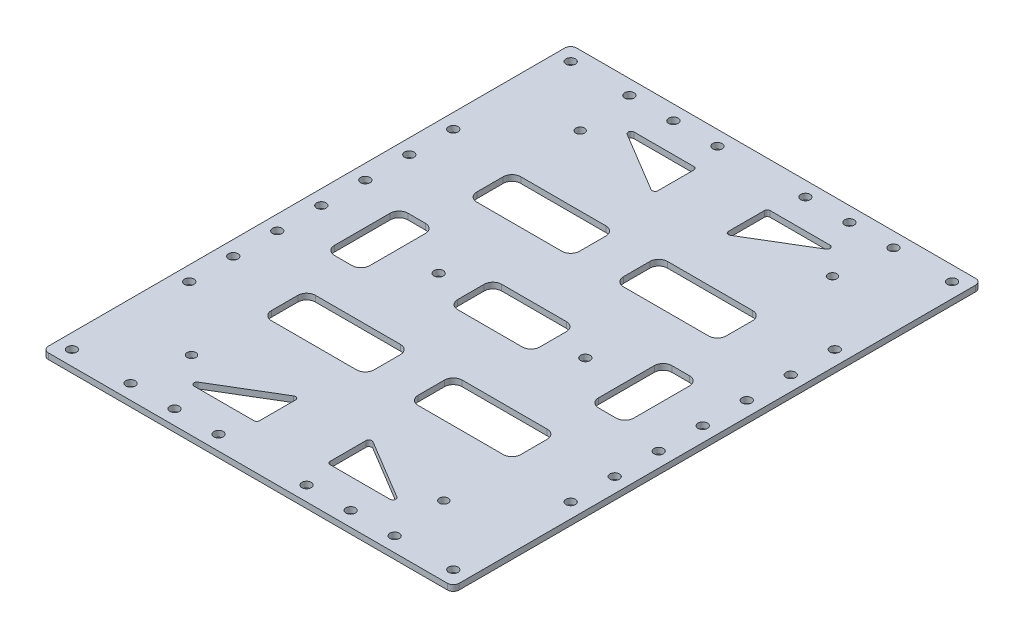
from build123d import *

# Parameters (mm, degrees)
SKETCH_1_W               = 180
SKETCH_1_H               = 180
EXTRUDE_1_DEPTH          = 2
SKETCH_2_R               = 1.5
CUT_EXTRUDE_1_DEPTH      = 3
SKETCH_3_W               = 28
SKETCH_3_H               = 15
SKETCH_3_W_2             = 35
SKETCH_3_W_3             = 12
SKETCH_3_H_2             = 25
CUT_EXTRUDE_2_DEPTH      = 3
FILLET_1_R               = 3
SKETCH_5_R               = 1.7
CUT_EXTRUDE_3_DEPTH      = 128.294933128
CUT_EXTRUDE_4_DEPTH      = 10
SKETCH_7_R               = 1.6
CUT_EXTRUDE_5_DEPTH      = 10
FILLET_2_R               = 3
FILLET_3_R               = 1
CUT_EXTRUDE_6_DEPTH      = 128.294933128
CUT_EXTRUDE_6_DEPTH_BACK = 128.294933128
SKETCH_8_R               = 1.6
FILLET_4_R               = 2


with BuildPart() as part:
    # 草图1 → 凸台-拉伸1 (new body)
    with BuildSketch(Plane(origin=(0, 0, 0), x_dir=(1, 0, 0), z_dir=(0, 1, 0))):
        Rectangle(SKETCH_1_W, SKETCH_1_H)
    extrude(amount=EXTRUDE_1_DEPTH)

    # 草图2 → 切除-拉伸1 (cut)
    with BuildSketch(Plane(origin=(0, 2, 0), x_dir=(1, 0, 0), z_dir=(0, 1, 0))):
        with Locations(Location((-42.9895, 66.2305, 0), (0, 0, 270))):
            Circle(SKETCH_2_R)
        with Locations(Location((42.9895, 66.2305, 0), (0, 0, 270))):
            Circle(SKETCH_2_R)
        with Locations(Location((-42.9895, -66.2305, 0), (0, 0, 270))):
            Circle(SKETCH_2_R)
        with Locations(Location((42.9895, -66.2305, 0), (0, 0, 270))):
            Circle(SKETCH_2_R)
    extrude(amount=-CUT_EXTRUDE_1_DEPTH, mode=Mode.SUBTRACT)

    # 草图3 → 切除-拉伸2 (cut)
    with BuildSketch(Plane(origin=(0, 2, 0), x_dir=(1, 0, 0), z_dir=(0, 1, 0))):
        Rectangle(SKETCH_3_W, SKETCH_3_H)
        with Locations((-25, 35)):
            Rectangle(SKETCH_3_W_2, SKETCH_3_H)
        with Locations((25, 35)):
            Rectangle(SKETCH_3_W_2, SKETCH_3_H)
        with Locations((45, 0)):
            Rectangle(SKETCH_3_W_3, SKETCH_3_H_2)
        with Locations((-45, 0)):
            Rectangle(SKETCH_3_W_3, SKETCH_3_H_2)
        with Locations((-25, -35)):
            Rectangle(SKETCH_3_W_2, SKETCH_3_H)
        with Locations((25, -35)):
            Rectangle(SKETCH_3_W_2, SKETCH_3_H)
        Polygon((-37, 75), (-12, 75), (-12, 60), align=None)
        Polygon((12, 75), (12, 60), (37, 75), align=None)
        Polygon((37, -75), (12, -75), (12, -60), align=None)
        Polygon((-12, -75), (-12, -60), (-37, -75), align=None)
    extrude(amount=-CUT_EXTRUDE_2_DEPTH, mode=Mode.SUBTRACT)

    # 圆角1
    fillet_1_edges = [part.edges().sort_by_distance(p)[0] for p in [
        (14, 1, -7.5),
        (14, 1, 7.5),
        (-14, 1, 7.5),
        (-14, 1, -7.5),
    ]]
    fillet(fillet_1_edges, radius=FILLET_1_R)

    # 草图5 → 切除-拉伸3 (cut, through all)
    with BuildSketch(Plane(origin=(0, 2, 0), x_dir=(1, 0, 0), z_dir=(0, 1, 0))):
        with Locations(Location((77.5, 69.014718626, 0), (0, 0, 270))):
            Circle(SKETCH_5_R)
        with Locations(Location((77.5, 85.985281374, 0), (0, 0, 270))):
            Circle(SKETCH_5_R)
        with Locations(Location((85.985281374, 77.5, 0), (0, 0, 270))):
            Circle(SKETCH_5_R)
        with Locations(Location((-85.985281374, 77.5, 0), (0, 0, 90))):
            Circle(SKETCH_5_R)
        with Locations(Location((-77.5, 85.985281374, 0), (0, 0, 90))):
            Circle(SKETCH_5_R)
        with Locations(Location((-77.5, -85.985281374, 0), (0, 0, 270))):
            Circle(SKETCH_5_R)
        with Locations(Location((-85.985281374, -77.5, 0), (0, 0, 270))):
            Circle(SKETCH_5_R)
        with Locations(Location((85.985281374, -77.5, 0), (0, 0, 90))):
            Circle(SKETCH_5_R)
        with Locations(Location((77.5, -85.985281374, 0), (0, 0, 90))):
            Circle(SKETCH_5_R)
        Polygon((80, 90), (90, 80), (90, 90), align=None)
        Polygon((-90, 90), (-80, 90), (-90, 80), align=None)
        Polygon((-80, -90), (-90, -80), (-90, -90), align=None)
        Polygon((90, -90), (80, -90), (90, -80), align=None)
    extrude(amount=-CUT_EXTRUDE_3_DEPTH, mode=Mode.SUBTRACT)

    # 草图6 → 切除-拉伸4 (cut)
    with BuildSketch(Plane(origin=(0, 2, 0), x_dir=(1, 0, 0), z_dir=(0, 1, 0))):
        Polygon((90, 70), (70, 50), (70, -50), (90, -70), align=None)
        Polygon((-70, -50), (-90, -70), (-90, 70), (-70, 50), align=None)
    extrude(amount=-CUT_EXTRUDE_4_DEPTH, mode=Mode.SUBTRACT)

    # 草图7 → 切除-拉伸5 (cut)
    with BuildSketch(Plane.XZ):
        with Locations(Location((-65, 30, 0), (0, 0, 270))):
            Circle(SKETCH_7_R)
        with Locations(Location((-65, 15, 0), (0, 0, 270))):
            Circle(SKETCH_7_R)
        with Locations(Location((-65, 45, 0), (0, 0, 270))):
            Circle(SKETCH_7_R)
        with Locations(Location((-45, 85, 0), (0, 0, 270))):
            Circle(SKETCH_7_R)
        with Locations(Location((-30, 85, 0), (0, 0, 270))):
            Circle(SKETCH_7_R)
        with Locations(Location((-15, 85, 0), (0, 0, 270))):
            Circle(SKETCH_7_R)
        with Locations(Location((15, 85, 0), (0, 0, 270))):
            Circle(SKETCH_7_R)
        with Locations(Location((30, 85, 0), (0, 0, 270))):
            Circle(SKETCH_7_R)
        with Locations(Location((45, 85, 0), (0, 0, 270))):
            Circle(SKETCH_7_R)
        with Locations(Location((-65, -45, 0), (0, 0, 270))):
            Circle(SKETCH_7_R)
        with Locations(Location((-65, -15, 0), (0, 0, 270))):
            Circle(SKETCH_7_R)
        with Locations(Location((-65, -30, 0), (0, 0, 270))):
            Circle(SKETCH_7_R)
        with Locations(Location((65, -30, 0), (0, 0, 270))):
            Circle(SKETCH_7_R)
        with Locations(Location((65, -15, 0), (0, 0, 270))):
            Circle(SKETCH_7_R)
        with Locations(Location((65, -45, 0), (0, 0, 270))):
            Circle(SKETCH_7_R)
        with Locations(Location((65, 45, 0), (0, 0, 270))):
            Circle(SKETCH_7_R)
        with Locations(Location((65, 15, 0), (0, 0, 270))):
            Circle(SKETCH_7_R)
        with Locations(Location((65, 30, 0), (0, 0, 270))):
            Circle(SKETCH_7_R)
        with Locations(Location((45, -85, 0), (0, 0, 270))):
            Circle(SKETCH_7_R)
        with Locations(Location((30, -85, 0), (0, 0, 270))):
            Circle(SKETCH_7_R)
        with Locations(Location((15, -85, 0), (0, 0, 270))):
            Circle(SKETCH_7_R)
        with Locations(Location((-15, -85, 0), (0, 0, 270))):
            Circle(SKETCH_7_R)
        with Locations(Location((-30, -85, 0), (0, 0, 270))):
            Circle(SKETCH_7_R)
        with Locations(Location((-45, -85, 0), (0, 0, 270))):
            Circle(SKETCH_7_R)
        with Locations(Location((-65, 85, 0), (0, 0, 270))):
            Circle(SKETCH_7_R)
        with Locations(Location((65, 85, 0), (0, 0, 270))):
            Circle(SKETCH_7_R)
        with Locations(Location((65, -85, 0), (0, 0, 270))):
            Circle(SKETCH_7_R)
        with Locations(Location((-65, -85, 0), (0, 0, 270))):
            Circle(SKETCH_7_R)
    extrude(amount=-CUT_EXTRUDE_5_DEPTH, mode=Mode.SUBTRACT)

    # 圆角2
    fillet_2_edges = [part.edges().sort_by_distance(p)[0] for p in [
        (42.5, 1, -42.5),
        (42.5, 1, -27.5),
        (7.5, 1, -27.5),
        (7.5, 1, -42.5),
        (-39, 1, -12.5),
        (-39, 1, 12.5),
        (-51, 1, 12.5),
        (-51, 1, -12.5),
        (51, 1, -12.5),
        (51, 1, 12.5),
        (39, 1, 12.5),
        (39, 1, -12.5),
        (-42.5, 1, 42.5),
        (-42.5, 1, 27.5),
        (-7.5, 1, 27.5),
        (-7.5, 1, 42.5),
        (7.5, 1, 27.5),
        (42.5, 1, 27.5),
        (42.5, 1, 42.5),
        (7.5, 1, 42.5),
        (-90, 1, -80),
        (-80, 1, -90),
        (80, 1, -90),
        (90, 1, -80),
        (90, 1, 80),
        (80, 1, 90),
        (-80, 1, 90),
        (-90, 1, 80),
        (90, 1, -70),
        (90, 1, 70),
        (70, 1, 50),
        (70, 1, -50),
        (-70, 1, -50),
        (-70, 1, 50),
        (-90, 1, 70),
        (-90, 1, -70),
        (-7.5, 1, -42.5),
        (-7.5, 1, -27.5),
        (-42.5, 1, -27.5),
        (-42.5, 1, -42.5),
    ]]
    fillet(fillet_2_edges, radius=FILLET_2_R)

    # 圆角3
    fillet_3_edges = [part.edges().sort_by_distance(p)[0] for p in [
        (-12, 1, -60),
        (-37, 1, -75),
        (-12, 1, -75),
        (12, 1, -75),
        (37, 1, -75),
        (12, 1, -60),
        (-12, 1, 75),
        (-37, 1, 75),
        (-12, 1, 60),
        (12, 1, 60),
        (37, 1, 75),
        (12, 1, 75),
    ]]
    fillet(fillet_3_edges, radius=FILLET_3_R)

    # 草图8 → 切除-拉伸6 (cut, two sides: drawn at the far end of the back side and taken through both)
    with BuildSketch(Plane(origin=(0, 2, 0), x_dir=(1, 0, 0), z_dir=(0, 1, 0)).offset(-CUT_EXTRUDE_6_DEPTH_BACK)):
        with BuildLine():
            Line((-70, 48.757359313), (-70, 90))
            Line((-70, 90), (-78.757359313, 90))
            ThreePointArc((-78.757359313, 90), (-79.90540961, 89.771638598), (-80.878679656, 89.121320344))
            Line((-80.878679656, 89.121320344), (-89.121320344, 80.878679656))
            ThreePointArc((-89.121320344, 80.878679656), (-89.771638598, 79.90540961), (-90, 78.757359313))
            Line((-90, 78.757359313), (-90, 71.242640687))
            ThreePointArc((-90, 71.242640687), (-89.771638598, 70.09459039), (-89.121320344, 69.121320344))
            Line((-89.121320344, 69.121320344), (-70.878679656, 50.878679656))
            ThreePointArc((-70.878679656, 50.878679656), (-70.228361402, 49.90540961), (-70, 48.757359313))
        make_face()
        with BuildLine():
            Line((-70, -90), (-70, -48.757359313))
            ThreePointArc((-70, -48.757359313), (-70.228361402, -49.90540961), (-70.878679656, -50.878679656))
            Line((-70.878679656, -50.878679656), (-89.121320344, -69.121320344))
            ThreePointArc((-89.121320344, -69.121320344), (-89.771638598, -70.09459039), (-90, -71.242640687))
            Line((-90, -71.242640687), (-90, -78.757359313))
            ThreePointArc((-90, -78.757359313), (-89.771638598, -79.90540961), (-89.121320344, -80.878679656))
            Line((-89.121320344, -80.878679656), (-80.878679656, -89.121320344))
            ThreePointArc((-80.878679656, -89.121320344), (-79.90540961, -89.771638598), (-78.757359313, -90))
            Line((-78.757359313, -90), (-70, -90))
        make_face()
        with BuildLine():
            ThreePointArc((70.878679656, -50.878679656), (70.228361402, -49.90540961), (70, -48.757359313))
            Line((70, -48.757359313), (70, -90))
            Line((70, -90), (78.757359313, -90))
            ThreePointArc((78.757359313, -90), (79.90540961, -89.771638598), (80.878679656, -89.121320344))
            Line((80.878679656, -89.121320344), (89.121320344, -80.878679656))
            ThreePointArc((89.121320344, -80.878679656), (89.771638598, -79.90540961), (90, -78.757359313))
            Line((90, -78.757359313), (90, -71.242640687))
            ThreePointArc((90, -71.242640687), (89.771638598, -70.09459039), (89.121320344, -69.121320344))
            Line((89.121320344, -69.121320344), (70.878679656, -50.878679656))
        make_face()
        with BuildLine():
            Line((78.757359313, 90), (70, 90))
            Line((70, 90), (70, 48.757359313))
            ThreePointArc((70, 48.757359313), (70.228361402, 49.90540961), (70.878679656, 50.878679656))
            Line((70.878679656, 50.878679656), (89.121320344, 69.121320344))
            ThreePointArc((89.121320344, 69.121320344), (89.771638598, 70.09459039), (90, 71.242640687))
            Line((90, 71.242640687), (90, 78.757359313))
            ThreePointArc((90, 78.757359313), (89.771638598, 79.90540961), (89.121320344, 80.878679656))
            Line((89.121320344, 80.878679656), (80.878679656, 89.121320344))
            ThreePointArc((80.878679656, 89.121320344), (79.90540961, 89.771638598), (78.757359313, 90))
        make_face()
        with Locations(Location((-65, 0, 0), (0, 0, 270))):
            Circle(SKETCH_8_R)
        with Locations(Location((-25, 0, 0), (0, 0, 270))):
            Circle(SKETCH_8_R)
        with Locations(Location((25, 0, 0), (0, 0, 90))):
            Circle(SKETCH_8_R)
        with Locations(Location((65, 0, 0), (0, 0, 90))):
            Circle(SKETCH_8_R)
    extrude(amount=CUT_EXTRUDE_6_DEPTH + CUT_EXTRUDE_6_DEPTH_BACK, mode=Mode.SUBTRACT)

    # 圆角4
    fillet_4_edges = [part.edges().sort_by_distance(p)[0] for p in [
        (-70, 1, 90),
        (70, 1, 90),
        (70, 1, -90),
        (-70, 1, -90),
    ]]
    fillet(fillet_4_edges, radius=FILLET_4_R)


solid = part.part
